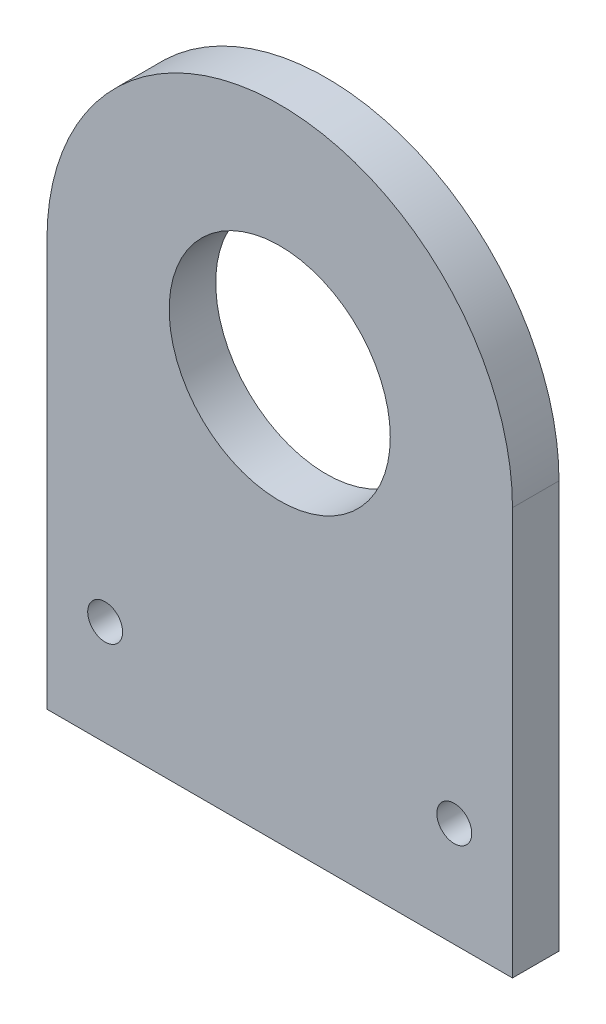
from build123d import *

# Parameters (mm, degrees)
SKETCH_1_R          = 20
EXTRUDE_1_DEPTH     = 4
SKETCH_2_R          = 9.5
CUT_EXTRUDE_1_DEPTH = 41.509258201
SKETCH_4_R          = 1.5
CUT_EXTRUDE_2_DEPTH = 41.509258201


with BuildPart() as part:
    # 草图1 → 凸台-拉伸1 (new body)
    with BuildSketch(Plane.XY):
        Circle(SKETCH_1_R)
        with BuildLine():
            ThreePointArc((20, 0), (0, -20), (-20, 0))
            Line((-20, 0), (-20, -35))
            Line((-20, -35), (20, -35))
            Line((20, -35), (20, 0))
        make_face()
    extrude(amount=EXTRUDE_1_DEPTH)

    # 草图2 → 切除-拉伸1 (cut, through all)
    with BuildSketch(Plane.XY.offset(4)):
        Circle(SKETCH_2_R)
    extrude(amount=-CUT_EXTRUDE_1_DEPTH, mode=Mode.SUBTRACT)

    # 草图4 → 切除-拉伸2 (cut, through all)
    with BuildSketch(Plane.XY.offset(4)):
        with Locations((-15, -26)):
            Circle(SKETCH_4_R)
        with Locations(Location((15, -26, 0), (0, 0, 180))):
            Circle(SKETCH_4_R)
    extrude(amount=-CUT_EXTRUDE_2_DEPTH, mode=Mode.SUBTRACT)


solid = part.part
